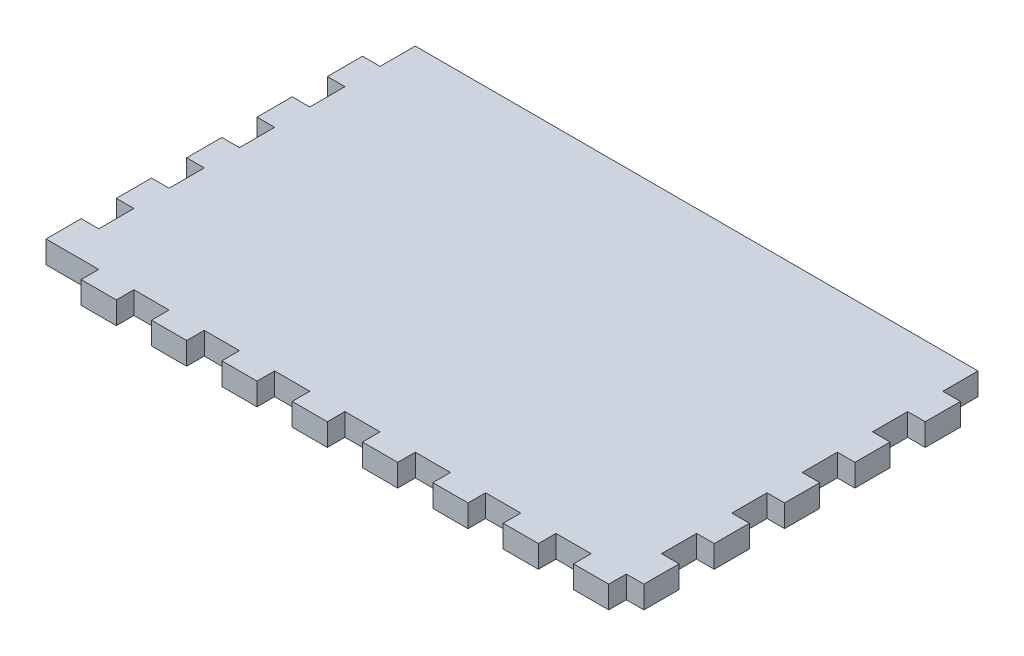
from build123d import *

# Parameters (mm, degrees)
SKETCH1_W           = 80
SKETCH1_H           = 50
BOSS_EXTRUDE1_DEPTH = 3.175
SKETCH2_W           = 5
SKETCH2_H           = 3.175
BOSS_EXTRUDE2_DEPTH = 2.5
LPATTERN1_COUNT     = 5
LPATTERN1_PITCH     = 10
SKETCH3_W           = 5
SKETCH3_H           = 3.175
BOSS_EXTRUDE3_DEPTH = 2.5
LPATTERN2_COUNT     = 5
LPATTERN2_PITCH     = 10
SKETCH4_W           = 5
SKETCH4_H           = 3.175
BOSS_EXTRUDE4_DEPTH = 2.5
LPATTERN3_COUNT     = 8
LPATTERN3_PITCH     = 10


with BuildPart() as part:
    # Sketch1 → Boss-Extrude1 (new body)
    with BuildSketch(Plane(origin=(0, 0, 0), x_dir=(1, 0, 0), z_dir=(0, 1, 0))):
        with Locations((40, 25)):
            Rectangle(SKETCH1_W, SKETCH1_H)
    extrude(amount=BOSS_EXTRUDE1_DEPTH)

    # Sketch2 → Boss-Extrude2 (add)
    with BuildSketch(Plane.ZY):
        with Locations((-2.5, 1.5875)):
            Rectangle(SKETCH2_W, SKETCH2_H)
    boss_extrude2 = extrude(amount=BOSS_EXTRUDE2_DEPTH)

    # LPattern1: Boss-Extrude2 ×5
    with Locations(*[(0, 0, -i * LPATTERN1_PITCH) for i in range(1, LPATTERN1_COUNT)]):
        add(boss_extrude2)

    # Sketch3 → Boss-Extrude3 (add)
    with BuildSketch(Plane(origin=(80, 0, 0), x_dir=(0, 0, -1), z_dir=(1, 0, 0))):
        with Locations((2.5, 1.5875)):
            Rectangle(SKETCH3_W, SKETCH3_H)
    boss_extrude3 = extrude(amount=BOSS_EXTRUDE3_DEPTH)

    # LPattern2: Boss-Extrude3 ×5
    with Locations(*[(0, 0, -i * LPATTERN2_PITCH) for i in range(1, LPATTERN2_COUNT)]):
        add(boss_extrude3)

    # Sketch4 → Boss-Extrude4 (add)
    with BuildSketch(Plane.XY):
        with Locations((77.5, 1.5875)):
            Rectangle(SKETCH4_W, SKETCH4_H)
    boss_extrude4 = extrude(amount=BOSS_EXTRUDE4_DEPTH)

    # LPattern3: Boss-Extrude4 ×8
    with Locations(*[(-i * LPATTERN3_PITCH, 0, 0) for i in range(1, LPATTERN3_COUNT)]):
        add(boss_extrude4)


solid = part.part
